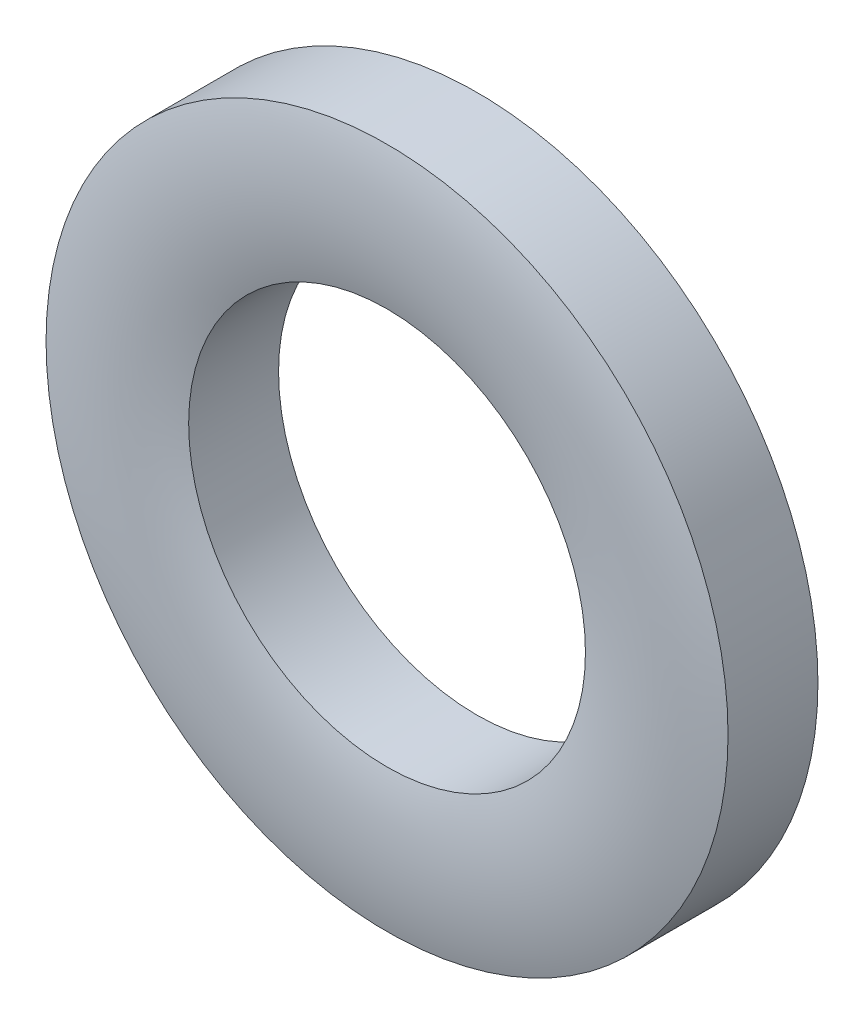
from build123d import *


with BuildPart() as part:
    # Sketch3 → Revolve1 (revolve)
    with BuildSketch(Plane(origin=(0, 0, 0), x_dir=(0, 0, -1), z_dir=(1, 0, 0)), mode=Mode.PRIVATE) as revolve1_sk:
        with BuildLine():
            Line((0.8, 5.5), (-0.65008, 5.5))
            ThreePointArc((-0.65008, 5.5), (-0.8, 4.35), (-0.65008, 3.2))
            Line((-0.65008, 3.2), (0.8, 3.2))
            Line((0.8, 3.2), (0.8, 5.5))
        make_face()
    revolve(revolve1_sk.sketch.rotate(Axis((0, 0, 0.8), (0, 0, -1)), 90), axis=Axis((0, 0, 0.8), (0, 0, -1)))


solid = part.part
